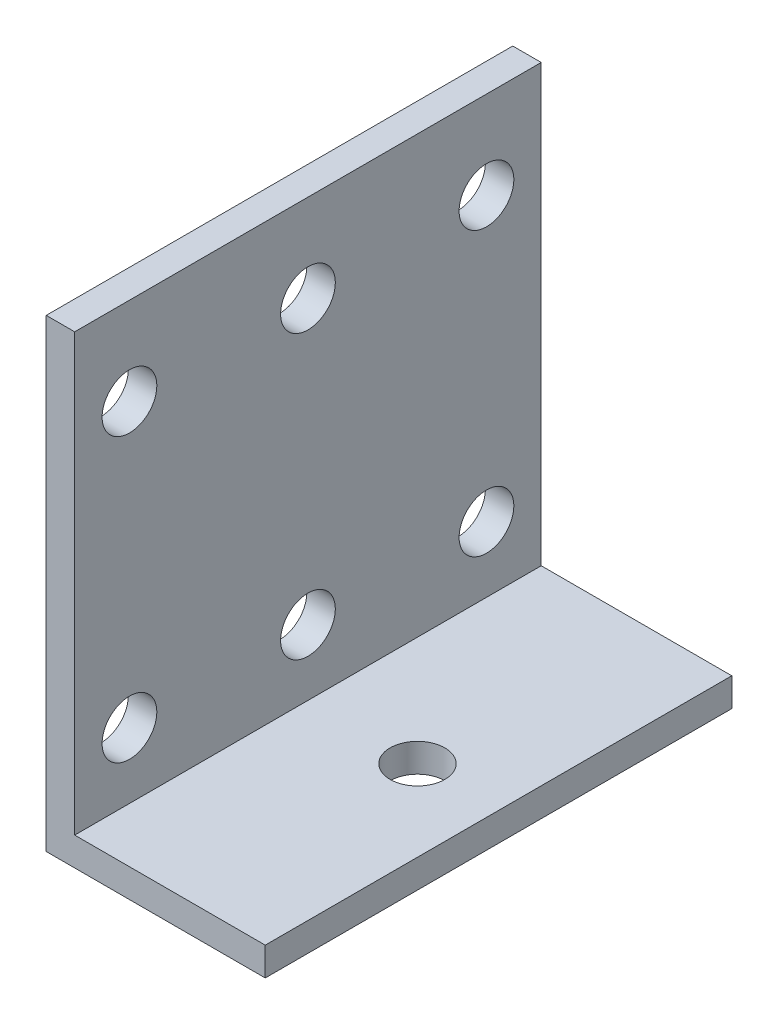
from build123d import *

# Parameters (mm, degrees)
SKETCH2_W                   = 25.4
SKETCH2_H                   = 54.102
BOSS_EXTRUDE1_DEPTH         = 3.302
SKETCH3_W                   = 3.302
SKETCH3_H                   = 54.102
BOSS_EXTRUDE2_DEPTH         = 50.546
F_1_4_0_25_DIAMETER_HOLE1_D = 6.35
F_1_4_0_25_DIAMETER_HOLE3_D = 6.35


with BuildPart() as part:
    # Sketch2 → Boss-Extrude1 (new body)
    with BuildSketch(Plane(origin=(0, 0, 0), x_dir=(1, 0, 0), z_dir=(0, 1, 0))):
        Rectangle(SKETCH2_W, SKETCH2_H)
    extrude(amount=BOSS_EXTRUDE1_DEPTH)

    # Sketch3 → Boss-Extrude2 (add)
    with BuildSketch(Plane(origin=(0, 3.302, 0), x_dir=(1, 0, 0), z_dir=(0, 1, 0))):
        with Locations((-11.049, 0)):
            Rectangle(SKETCH3_W, SKETCH3_H)
    extrude(amount=BOSS_EXTRUDE2_DEPTH)

    # 1/4 (0.25) Diameter Hole1 (through all)
    with Locations(Plane(origin=(-9.398, 0, 0), x_dir=(0, 0, -1), z_dir=(1, 0, 0))):
        with Locations((-20.701, 43.685729795), (0, 43.685729795), (20.701, 43.685729795), (20.701, 10.909480531), (0, 10.909480531), (-20.701, 10.909480531)):
            Hole(F_1_4_0_25_DIAMETER_HOLE1_D / 2)

    # 1/4 (0.25) Diameter Hole3 (through all)
    with Locations(Plane(origin=(0, 3.302, 0), x_dir=(1, 0, 0), z_dir=(0, 1, 0))):
        with Locations((3.302, 0)):
            Hole(F_1_4_0_25_DIAMETER_HOLE3_D / 2)


solid = part.part
